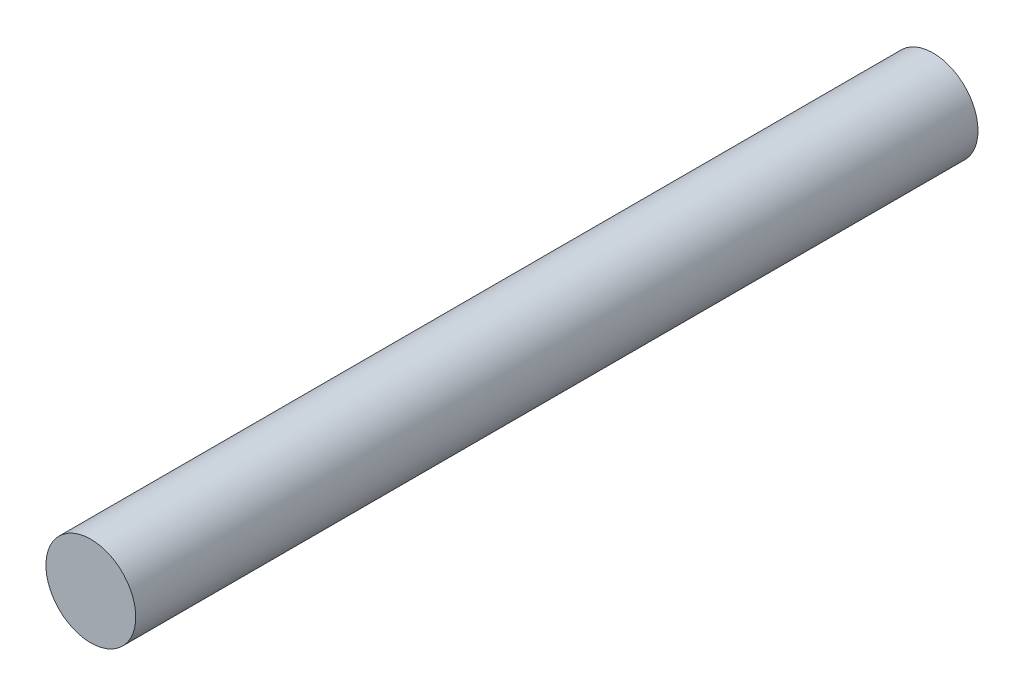
from build123d import *

# Parameters (mm, degrees)
SKETCH1_R           = 0.8
BOSS_EXTRUDE1_DEPTH = 15


with BuildPart() as part:
    # Sketch1 → Boss-Extrude1 (new body)
    with BuildSketch(Plane.XY):
        with Locations((36.375874401, 14.122428948)):
            Circle(SKETCH1_R)
    extrude(amount=BOSS_EXTRUDE1_DEPTH)


solid = part.part
